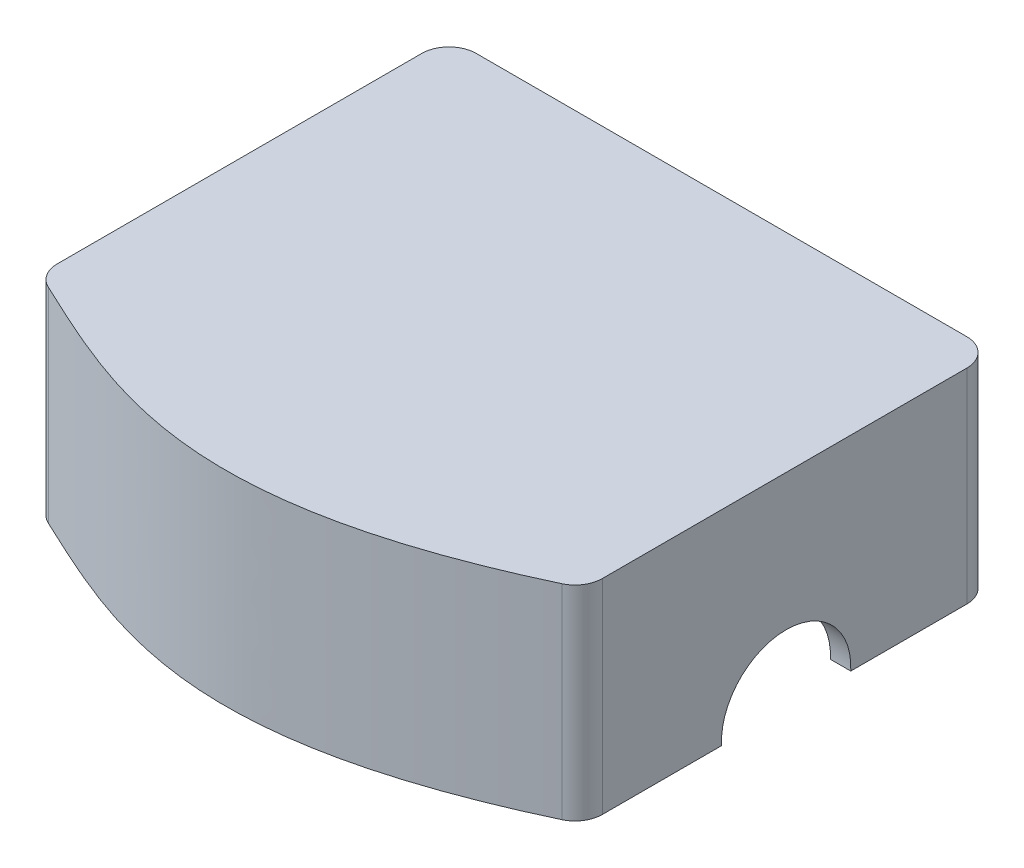
from build123d import *

# Parameters (mm, degrees)
BOSS_EXTRUDE5_DEPTH = 150
CUT_EXTRUDE4_DEPTH  = 130
SKETCH8_R           = 47.5
CUT_EXTRUDE5_DEPTH  = 475.65402898


with BuildPart() as part:
    # Sketch1 → Boss-Extrude5 (new body)
    with BuildSketch(Plane(origin=(0, 0, 0), x_dir=(1, 0, 0), z_dir=(0, 1, 0))):
        with BuildLine():
            Line((-180, 150), (180, 150))
            ThreePointArc((180, 150), (194.142135624, 144.142135624), (200, 130))
            Line((200, 130), (200, -137.480797285))
            ThreePointArc((200, -137.480797285), (196.889858076, -148.19213213), (188.526730584, -155.572089819))
            add(Edge.make_bspline(
                [(-188.526730584, -155.572089819), (-94.263365292, -200), (0, -244.427910181), (188.526730584, -155.572089819)],
                knots=[0, 0, 0, 0, 1, 1, 1, 1], degree=3))
            ThreePointArc((-188.526730584, -155.572089819), (-196.889858076, -148.19213213), (-200, -137.480797285))
            Line((-200, -137.480797285), (-200, 130))
            ThreePointArc((-200, 130), (-194.142135624, 144.142135624), (-180, 150))
        make_face()
    extrude(amount=BOSS_EXTRUDE5_DEPTH)

    # Sketch7 → Cut-Extrude4 (cut)
    with BuildSketch(Plane.XZ):
        with BuildLine():
            Line((-180, -135), (180, -135))
            ThreePointArc((180, -135), (183.535533906, -133.535533906), (185, -130))
            Line((185, -130), (185, 137.480797285))
            ThreePointArc((185, 137.480797285), (184.222464519, 140.158630996), (182.131682646, 142.003620419))
            add(Edge.make_bspline(
                [(182.131682646, 142.003620419), (167.754395175, 148.779877923), (153.243793404, 155.096016084), (123.887544981, 166.571922609), (109.042273823, 171.732986949), (86.451364448, 178.35977611), (78.866974419, 180.382030951), (63.574333937, 183.999050287), (55.866097219, 185.593862184), (40.307101742, 188.29158715), (32.456347746, 189.394516661), (20.556839665, 190.62308876), (16.569747475, 190.961550457), (8.551333739, 191.485821191), (4.544231323, 191.669927655), (-7.454411488, 191.980616602), (-15.430189587, 191.865523988), (-31.333284121, 190.965648075), (-39.260577272, 190.180543026), (-51.114854999, 188.496254108), (-55.060184136, 187.85057332), (-60.969143231, 186.757203044), (-62.937291634, 186.371953854), (-66.870612209, 185.560327), (-68.836067076, 185.13383579), (-78.618097665, 182.909176108), (-86.329542172, 180.827443766), (-101.559170643, 176.152807331), (-109.077405353, 173.560037463), (-123.963089417, 167.97567232), (-131.330609371, 164.984263785), (-153.278917059, 155.602043077), (-167.705359418, 148.8029893), (-182.131682646, 142.003620419)],
                knots=[0, 0, 0, 0, 0.125, 0.125, 0.25, 0.25, 0.3125, 0.3125, 0.375, 0.375, 0.4375, 0.4375, 0.46875, 0.46875, 0.5, 0.5, 0.5625, 0.5625, 0.625, 0.625, 0.65625, 0.65625, 0.671875, 0.671875, 0.6875, 0.6875, 0.75, 0.75, 0.8125, 0.8125, 0.875, 0.875, 1, 1, 1, 1], degree=3))
            ThreePointArc((-182.131682646, 142.003620419), (-184.222464519, 140.158630996), (-185, 137.480797285))
            Line((-185, 137.480797285), (-185, -130))
            ThreePointArc((-185, -130), (-183.535533906, -133.535533906), (-180, -135))
        make_face()
    extrude(amount=-CUT_EXTRUDE4_DEPTH, mode=Mode.SUBTRACT)

    # Sketch8 → Cut-Extrude5 (cut, through all)
    with BuildSketch(Plane(origin=(200, 0, 0), x_dir=(0, 0, -1), z_dir=(1, 0, 0))):
        with Locations((-2.574719222, 2.5)):
            Circle(SKETCH8_R)
    extrude(amount=-CUT_EXTRUDE5_DEPTH, mode=Mode.SUBTRACT)


solid = part.part
